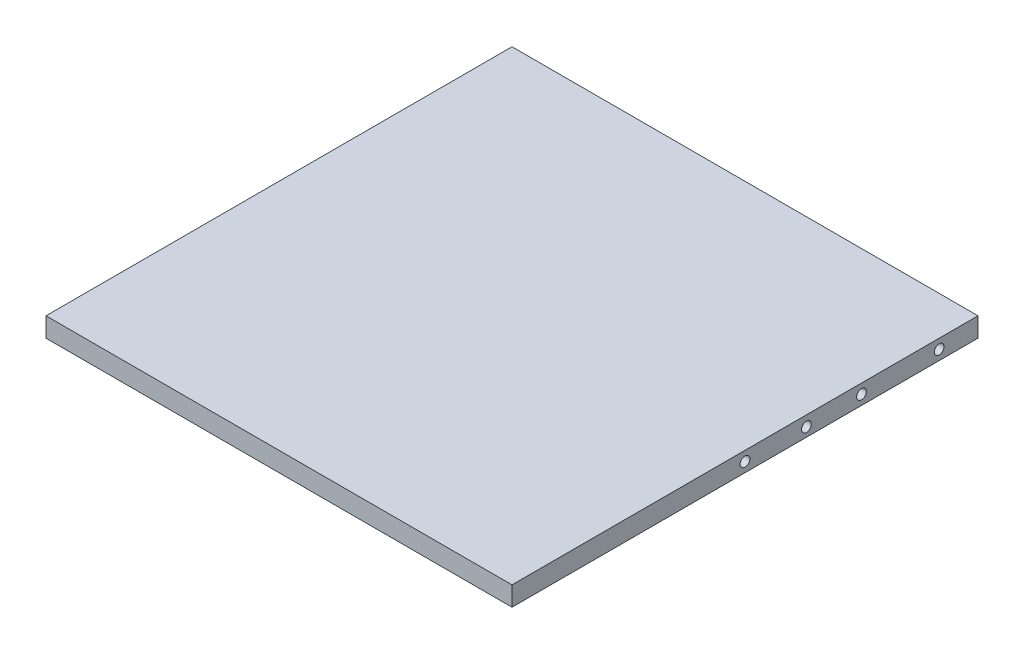
from build123d import *

# Parameters (mm, degrees)
SKETCH2_W               = 304.8
SKETCH2_H               = 304.8
BOSS_EXTRUDE1_DEPTH     = 12.7
SKETCH3_R               = 3.175
CUT_EXTRUDE1_DEPTH      = 343.16151121
SKETCH4_R               = 3.175
CUT_EXTRUDE2_DEPTH      = 343.16151121
CUT_EXTRUDE7_DEPTH      = 343.16151121
CUT_EXTRUDE7_DEPTH_BACK = 343.16151121
SKETCH5_R               = 3.175
CUT_EXTRUDE8_DEPTH      = 343.16151121
CUT_EXTRUDE8_DEPTH_BACK = 343.16151121
SKETCH6_R               = 3.175
SCALE1_SCALE            = 1.5


with BuildPart() as part:
    # Sketch2 → Boss-Extrude1 (new body)
    with BuildSketch(Plane(origin=(0, 0, 0), x_dir=(1, 0, 0), z_dir=(0, 1, 0))):
        with Locations((-98.332011444, 2.55215311)):
            Rectangle(SKETCH2_W, SKETCH2_H)
    extrude(amount=BOSS_EXTRUDE1_DEPTH)

    # Sketch3 → Cut-Extrude1 (cut, through all)
    with BuildSketch(Plane(origin=(54.067988556, 0, 0), x_dir=(0, 0, -1), z_dir=(1, 0, 0))):
        with Locations((2.55215311, 6.35)):
            Circle(SKETCH3_R)
    extrude(amount=-CUT_EXTRUDE1_DEPTH, mode=Mode.SUBTRACT)

    # Sketch4 → Cut-Extrude2 (cut, through all)
    with BuildSketch(Plane.ZY.offset(250.732011444)):
        with Locations((-42.726167629, 5.894382634)):
            Circle(SKETCH4_R)
    extrude(amount=-CUT_EXTRUDE2_DEPTH, mode=Mode.SUBTRACT)

    # Sketch5 → Cut-Extrude7 (cut, two sides: drawn at the far end of the back side and taken through both)
    with BuildSketch(Plane.ZY.offset(250.732011444).offset(-CUT_EXTRUDE7_DEPTH_BACK)):
        with Locations((-78.75215311, 6.35)):
            Circle(SKETCH5_R)
    extrude(amount=CUT_EXTRUDE7_DEPTH + CUT_EXTRUDE7_DEPTH_BACK, mode=Mode.SUBTRACT)

    # Sketch6 → Cut-Extrude8 (cut, two sides: drawn at the far end of the back side and taken through both)
    with BuildSketch(Plane.ZY.offset(250.732011444).offset(-CUT_EXTRUDE8_DEPTH_BACK)):
        with Locations((-129.55215311, 6.35)):
            Circle(SKETCH6_R)
    extrude(amount=CUT_EXTRUDE8_DEPTH + CUT_EXTRUDE8_DEPTH_BACK, mode=Mode.SUBTRACT)


with BuildPart() as part_1:
    # Scale1: scaled about (-98.332011444, 6.35385362, -0.493691098)
    add(part.part.scale(SCALE1_SCALE).moved(Location((49.166005722, -3.17692681, 0.246845549))))


solid = part_1.part
